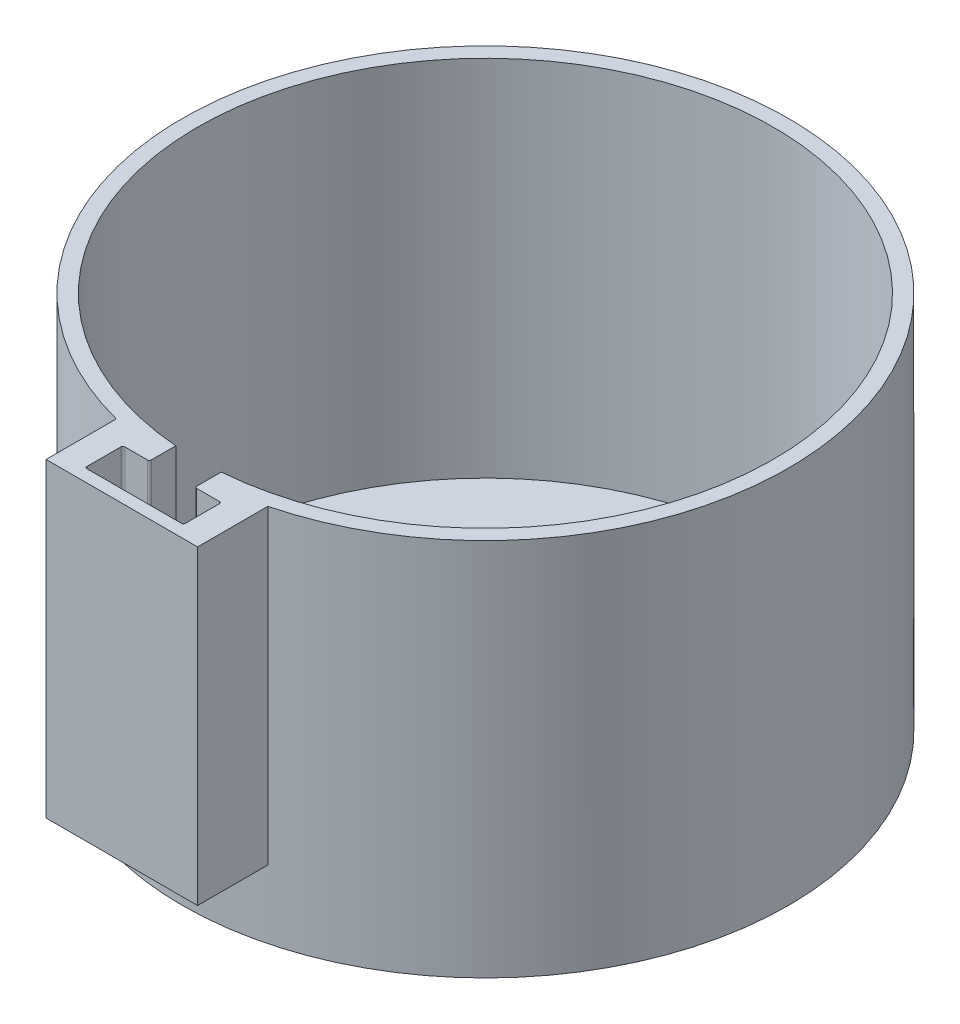
from build123d import *
from build123d.topology import SkipClean

# Parameters (mm, degrees)
SKETCH1_R           = 40
BOSS_EXTRUDE1_DEPTH = 40
SKETCH2_R           = 38
CUT_EXTRUDE1_DEPTH  = 38
CUT_EXTRUDE2_DEPTH  = 38
SKETCH4_R           = 5
CUT_EXTRUDE3_DEPTH  = 38
SKETCH6_R           = 2
BOSS_EXTRUDE2_DEPTH = 2
BOSS_EXTRUDE3_START = 10
SKETCH9_R           = 40
SKETCH9_R_2         = 38
BOSS_EXTRUDE3_DEPTH = 10
BOSS_EXTRUDE4_DEPTH = 41
CUT_EXTRUDE4_DEPTH  = 39
FILLET1_R           = 0.25
SKETCH13_R          = 3
CUT_EXTRUDE5_DEPTH  = 10


with BuildPart() as part:
    # Sketch1 → Boss-Extrude1 (new body)
    with BuildSketch(Plane(origin=(0, 0, 0), x_dir=(1, 0, 0), z_dir=(0, 1, 0))):
        with Locations(Location((0, 0, 0), (0, 0, 270))):
            Circle(SKETCH1_R)
    extrude(amount=BOSS_EXTRUDE1_DEPTH)

    # Sketch2 → Cut-Extrude1 (cut)
    with BuildSketch(Plane(origin=(0, 40, 0), x_dir=(1, 0, 0), z_dir=(0, 1, 0))):
        with Locations(Location((0, 0, 0), (0, 0, 270))):
            Circle(SKETCH2_R)
    extrude(amount=-CUT_EXTRUDE1_DEPTH, mode=Mode.SUBTRACT)

    # Sketch3 → Cut-Extrude2 (cut)
    with SkipClean():  # the faces are left unmerged after this step: merging them gives an invalid solid
        with BuildSketch(Plane(origin=(0, 2, 0), x_dir=(1, 0, 0), z_dir=(0, 1, 0))):
            with BuildLine():
                ThreePointArc((-14.076066703, -35.296803626), (0, -24.534862453), (14.076066703, -35.296803626))
                ThreePointArc((14.076066703, -35.296803626), (0, -38), (-14.076066703, -35.296803626))
            make_face()
        extrude(amount=-CUT_EXTRUDE2_DEPTH, mode=Mode.SUBTRACT)

    # Sketch4 → Cut-Extrude3 (cut)
    with SkipClean():  # the faces are left unmerged after this step: merging them gives an invalid solid
        with BuildSketch(Plane(origin=(0, 2, 0), x_dir=(1, 0, 0), z_dir=(0, 1, 0))):
            with Locations(Location((0, 0, 0), (0, 0, 270))):
                Circle(SKETCH4_R)
        extrude(amount=-CUT_EXTRUDE3_DEPTH, mode=Mode.SUBTRACT)

    # Sketch6 → Boss-Extrude2 (add)
    with SkipClean():  # the faces are left unmerged after this step: merging them gives an invalid solid
        with BuildSketch(Plane.XZ):
            with Locations(Location((-20, 0, 0), (0, 0, 90))):
                Circle(SKETCH6_R)
            with Locations(Location((20, 0, 0), (0, 0, 90))):
                Circle(SKETCH6_R)
        extrude(amount=BOSS_EXTRUDE2_DEPTH)

    # Sketch9 → Boss-Extrude3 (add)
    with SkipClean():  # the faces are left unmerged after this step: merging them gives an invalid solid
        with BuildSketch(Plane(origin=(0, 40, 0), x_dir=(1, 0, 0), z_dir=(0, 1, 0)).offset(BOSS_EXTRUDE3_START)):
            with Locations(Location((0, 0, 0), (0, 0, 270))):
                Circle(SKETCH9_R)
            with Locations(Location((0, 0, 0), (0, 0, 270))):
                Circle(SKETCH9_R_2, mode=Mode.SUBTRACT)
        extrude(amount=-BOSS_EXTRUDE3_DEPTH)

    # Sketch10 → Boss-Extrude4 (add)
    with SkipClean():  # the faces are left unmerged after this step: merging them gives an invalid solid
        with BuildSketch(Plane(origin=(0, 50, 0), x_dir=(1, 0, 0), z_dir=(0, 1, 0))):
            Polygon((0, -38), (10, -38), (10, -48), (-10, -48), (-10, -38), align=None)
        extrude(amount=-BOSS_EXTRUDE4_DEPTH)

    # Sketch11 → Cut-Extrude4 (cut)
    with SkipClean():  # the faces are left unmerged after this step: merging them gives an invalid solid
        with BuildSketch(Plane(origin=(0, 50, 0), x_dir=(1, 0, 0), z_dir=(0, 1, 0))):
            Polygon((-3, -36.864916731), (3, -36.864916731), (3, -41.364916731), (6.5, -41.364916731), (6.5, -46.364916731), (-6.5, -46.364916731), (-6.5, -41.364916731), (-3, -41.364916731), align=None)
        extrude(amount=-CUT_EXTRUDE4_DEPTH, mode=Mode.SUBTRACT)

    # Fillet1
    fillet1_edges = [part.edges().sort_by_distance(p)[0] for p in [
        (-3, 30.5, 41.364916731),
        (6.5, 30.5, 46.364916731),
        (-6.5, 30.5, 46.364916731),
        (-6.5, 30.5, 41.364916731),
        (3, 30.5, 41.364916731),
        (6.5, 30.5, 41.364916731),
    ]]
    fillet(fillet1_edges, radius=FILLET1_R)

    # Sketch13 → Cut-Extrude5 (cut)
    with BuildSketch(Plane.XZ):
        with Locations(Location((-30, 0, 0), (0, 0, 270))):
            Circle(SKETCH13_R)
        with Locations(Location((30, 0, 0), (0, 0, 270))):
            Circle(SKETCH13_R)
    extrude(amount=-CUT_EXTRUDE5_DEPTH, mode=Mode.SUBTRACT)


solid = part.part
